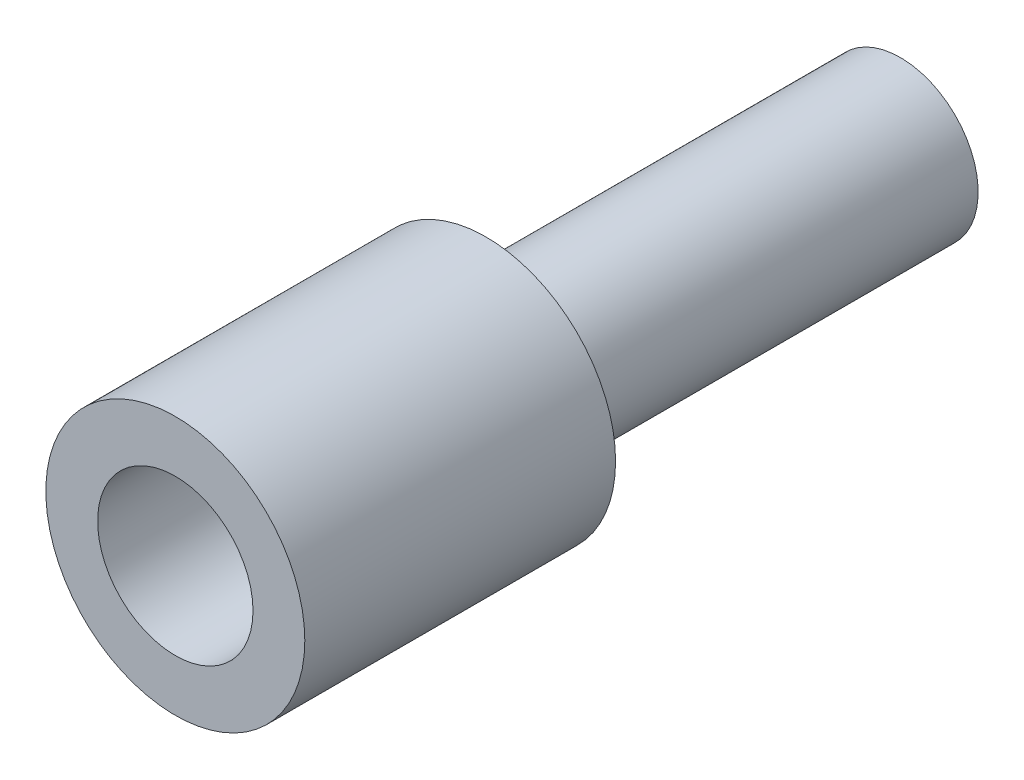
from build123d import *

# Parameters (mm, degrees)
ESQUISSE1_R             = 2.5
BOSS_EXTRU_1_DEPTH      = 6
ESQUISSE2_R             = 1.5
ENL_V_MAT_EXTRU_1_DEPTH = 5
ESQUISSE3_R             = 1.5
BOSS_EXTRU_2_DEPTH      = 8


with BuildPart() as part:
    # Esquisse1 → Boss.-Extru.1 (new body)
    with BuildSketch(Plane.XY):
        Circle(ESQUISSE1_R)
    extrude(amount=BOSS_EXTRU_1_DEPTH)

    # Esquisse2 → Enlèv. mat.-Extru.1 (cut)
    with BuildSketch(Plane.XY.offset(6)):
        Circle(ESQUISSE2_R)
    extrude(amount=-ENL_V_MAT_EXTRU_1_DEPTH, mode=Mode.SUBTRACT)

    # Esquisse3 → Boss.-Extru.2 (add)
    with BuildSketch(Plane(origin=(0, 0, 0), x_dir=(-1, 0, 0), z_dir=(0, 0, -1))):
        with Locations(Location((0, 0, 0), (0, 0, 180))):
            Circle(ESQUISSE3_R)
    extrude(amount=BOSS_EXTRU_2_DEPTH)


solid = part.part
